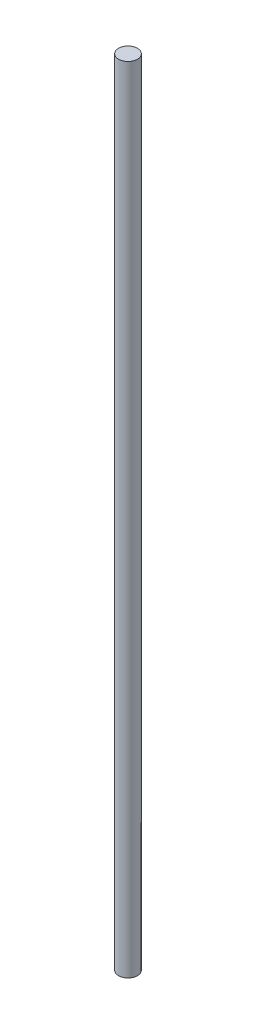
from build123d import *

# Parameters (mm, degrees)
SKETCH1_R           = 7.5
BOSS_EXTRUDE2_DEPTH = 630


with BuildPart() as part:
    # Sketch1 → Boss-Extrude2 (new body)
    with BuildSketch(Plane(origin=(0, 0, 0), x_dir=(1, 0, 0), z_dir=(0, 1, 0))):
        with Locations(Location((0, 0, 0), (0, 0, 270))):
            Circle(SKETCH1_R)
    extrude(amount=BOSS_EXTRUDE2_DEPTH)


solid = part.part
